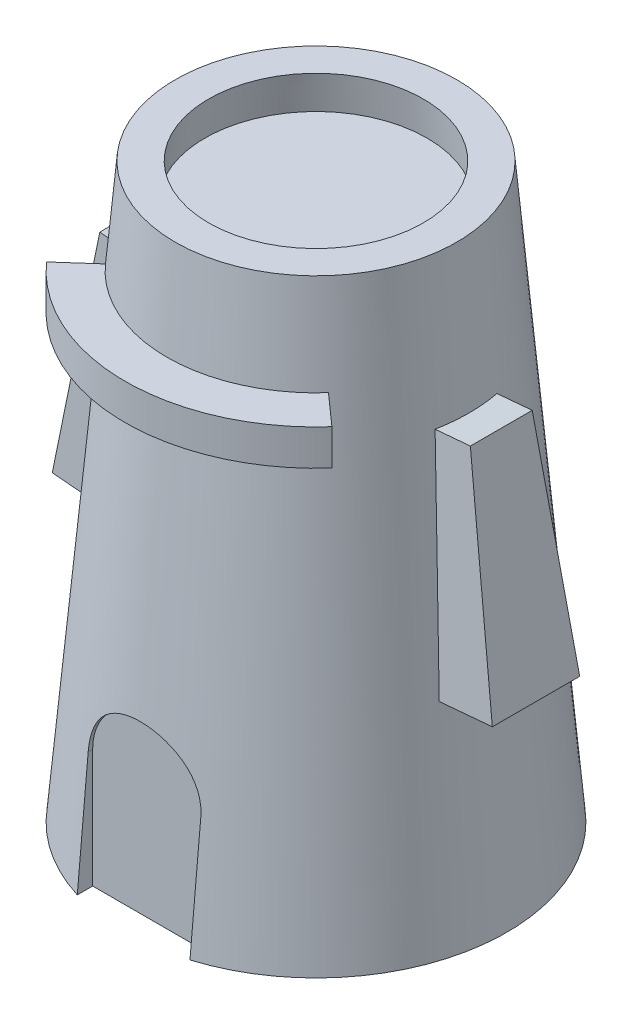
from build123d import *

# Parameters (mm, degrees)
SKETCH_1_R           = 16
EXTRUDE_1_DEPTH      = 48
EXTRUDE_1_TAPER      = 5
SKETCH_2_R           = 9
CUT_EXTRUDE_1_DEPTH  = 3
CUT_EXTRUDE_1_DRAFT  = 6
CUT_EXTRUDE_2_DEPTH  = 2
SKETCH_6_R           = 12.5
CUT_EXTRUDE_3_DEPTH  = 43
CUT_EXTRUDE_3_TAPER  = 5
EXTRUDE_2_DEPTH      = 3
EXTRUDE_3_DEPTH      = 4
EXTRUDE_3_DEPTH_BACK = 1
CUT_EXTRUDE_5_DEPTH  = 5


with BuildPart() as part:
    # 草图1 → 凸台-拉伸1 (new body)
    with BuildSketch(Plane(origin=(0, 0, 0), x_dir=(1, 0, 0), z_dir=(0, 1, 0))):
        Circle(SKETCH_1_R)
    extrude(amount=EXTRUDE_1_DEPTH, taper=EXTRUDE_1_TAPER)


with BuildPart() as cut_extrude_1_tool:
    # 草图2 → 切除-拉伸1 (with draft: the straight prism first)
    with BuildSketch(Plane(origin=(0, 48, 0), x_dir=(1, 0, 0), z_dir=(0, 1, 0))):
        Circle(SKETCH_2_R)
    extrude(amount=-CUT_EXTRUDE_1_DEPTH)
    # 切除-拉伸1: the draft: its side faces are tilted about the plane it starts from
    cut_extrude_1_sides = [cut_extrude_1_tool.faces().sort_by_distance(p)[0] for p in [
        (-9, 46.5, 0),
    ]]
    draft(cut_extrude_1_sides, Plane(origin=(0, 48, 0), x_dir=(1, 0, 0), z_dir=(0, 1, 0)), CUT_EXTRUDE_1_DRAFT)


with BuildPart() as part_1:
    add(part.part)

    # 切除-拉伸1: cut by cut_extrude_1_tool
    add(cut_extrude_1_tool.part, mode=Mode.SUBTRACT)

    # 草图3 → 切除-拉伸2 (cut)
    with BuildSketch(Plane.XY.offset(16)):
        with BuildLine():
            Line((-4.721374977, 0), (4.721374977, 0))
            Line((4.721374977, 0), (4.721374977, 9.932117857))
            ThreePointArc((4.721374977, 9.932117857), (0, 14.653492833), (-4.721374977, 9.932117857))
            Line((-4.721374977, 9.932117857), (-4.721374977, 0))
        make_face()
    extrude(amount=-CUT_EXTRUDE_2_DEPTH, mode=Mode.SUBTRACT)

    # 草图6 → 切除-拉伸3 (cut)
    with BuildSketch(Plane(origin=(0, 0, 0), x_dir=(1, 0, 0), z_dir=(0, 1, 0))):
        Circle(SKETCH_6_R)
    extrude(amount=CUT_EXTRUDE_3_DEPTH, taper=CUT_EXTRUDE_3_TAPER, mode=Mode.SUBTRACT)

    # 草图8 → 凸台-拉伸2 (add)
    with BuildSketch(Plane(origin=(0, 40, 0), x_dir=(1, 0, 0), z_dir=(0, 1, 0))):
        with BuildLine():
            Line((-11.961452846, -10.626553807), (-9.345224038, -8.302296331))
            ThreePointArc((-9.345224038, -8.302296331), (0, -12.500453459), (9.345224038, -8.302296331))
            Line((9.345224038, -8.302296331), (11.961452846, -10.626553807))
            ThreePointArc((11.961452846, -10.626553807), (0, -16), (-11.961452846, -10.626553807))
        make_face()
    extrude(amount=-EXTRUDE_2_DEPTH)

    # 草图9 → 凸台-拉伸3 (add, two sides: drawn at the far end of the back side and taken through both)
    with BuildSketch(Plane(origin=(15.878462024, 1.389185421, 0), x_dir=(0, 0, -1), z_dir=(0.9961946980917457, 0.0871557427476584, 0)).offset(-EXTRUDE_3_DEPTH_BACK)):
        Polygon((-2.592399587, 34.872205125), (2.592399587, 34.872205125), (3.662079691, 16.297695401), (-3.662079691, 16.297695401), align=None)
    extrude(amount=EXTRUDE_3_DEPTH + EXTRUDE_3_DEPTH_BACK)

    # 草图11 → 切除-拉伸5 (cut)
    with BuildSketch(Plane(origin=(20.768531886, 3.289412299, 0), x_dir=(0, 0, -1), z_dir=(0.9876883405951382, 0.15643446504022776, 0))):
        Polygon((2.592399587, 33.486979454), (-2.592399587, 33.486979454), (-3.662079691, 14.86711267), (3.662079691, 14.86711267), align=None)
    extrude(amount=CUT_EXTRUDE_5_DEPTH, mode=Mode.SUBTRACT)

    # 镜向1: part across plane


with BuildPart() as part_2:
    add(part_1.part)
    add(part_1.part.mirror(Plane(origin=(0, 0, 0), x_dir=(0, 0, 1), z_dir=(1, 0, 0))))


solid = part_2.part
